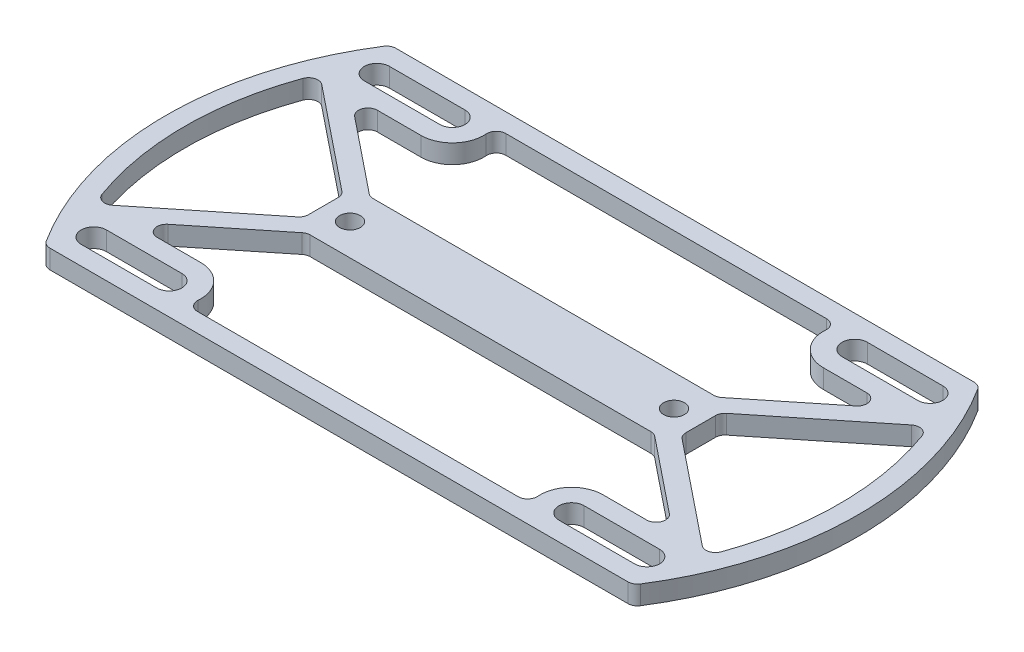
from build123d import *

# Parameters (mm, degrees)
EXTRUDE_1_DEPTH = 3
SKETCH_3_W      = 60
SKETCH_3_H      = 10
EXTRUDE_3_DEPTH = 3
EXTRUDE_4_DEPTH = 3
EXTRUDE_5_DEPTH = 3
FILLET_1_R      = 1.5
FILLET_2_R      = 1.5
M4X0_71_D       = 3.3


with BuildPart() as part:
    # Эскиз1 → Бобышка-Вытянуть1 (new body)
    with BuildSketch(Plane(origin=(0, 0, 0), x_dir=(1, 0, 0), z_dir=(0, 1, 0))):
        with BuildLine():
            Line((8.241767279, 0), (101.758232721, 0))
            ThreePointArc((101.758232721, 0), (110, 27.5), (101.758232721, 55))
            Line((101.758232721, 55), (8.241767279, 55))
            ThreePointArc((8.241767279, 55), (0, 27.5), (8.241767279, 0))
        make_face()
        with BuildLine():
            Line((9.890774129, 3), (100.109225871, 3))
            ThreePointArc((100.109225871, 3), (107, 27.5), (100.109225871, 52))
            Line((100.109225871, 52), (9.890774129, 52))
            ThreePointArc((9.890774129, 52), (3, 27.5), (9.890774129, 3))
        make_face(mode=Mode.SUBTRACT)
    extrude(amount=EXTRUDE_1_DEPTH)

    # Эскиз4 → Бобышка-Вытянуть4 (add, through all)
    with BuildSketch(Plane.XZ):
        with BuildLine():
            Line((27.611432525, -3), (23.02885683, -3))
            ThreePointArc((23.02885683, -3), (25.02885683, -5), (23.02885683, -7))
            Line((23.02885683, -7), (11.02885683, -7))
            ThreePointArc((11.02885683, -7), (9.296806041, -6.000000032), (9.296805985, -4.000000064))
            ThreePointArc((9.296805985, -4.000000064), (8.176529623, -6.057114801), (7.160134889, -8.167489628))
            ThreePointArc((7.160134889, -8.167489628), (8.888465293, -9.51870823), (11.02885683, -10))
            Line((11.02885683, -10), (23.02885683, -10))
            ThreePointArc((23.02885683, -10), (27.212156962, -7.738612788), (27.611432525, -3))
        make_face()
        with BuildLine():
            ThreePointArc((9.296805985, -4.000000064), (10.028856798, -3.267949211), (11.02885683, -3))
            Line((11.02885683, -3), (9.890774129, -3))
            ThreePointArc((9.890774129, -3), (9.590696591, -3.498162612), (9.296805985, -4.000000064))
        make_face()
        with BuildLine():
            Line((86.97114317, -3), (82.388567475, -3))
            ThreePointArc((82.388567475, -3), (82.787843038, -7.738612788), (86.97114317, -10))
            Line((86.97114317, -10), (98.97114317, -10))
            ThreePointArc((98.97114317, -10), (101.111534707, -9.51870823), (102.839865111, -8.167489628))
            ThreePointArc((102.839865111, -8.167489628), (101.823470359, -6.057114766), (100.703193976, -3.999999997))
            ThreePointArc((100.703193976, -3.999999997), (100.703193979, -5.999999998), (98.97114317, -7))
            Line((98.97114317, -7), (86.97114317, -7))
            ThreePointArc((86.97114317, -7), (84.97114317, -5), (86.97114317, -3))
        make_face()
        with BuildLine():
            Line((100.109225871, -3), (98.97114317, -3))
            ThreePointArc((98.97114317, -3), (99.971143169, -3.267949191), (100.703193976, -3.999999997))
            ThreePointArc((100.703193976, -3.999999997), (100.409303389, -3.498162579), (100.109225871, -3))
        make_face()
        with BuildLine():
            ThreePointArc((100.703194034, -50.999999903), (101.823470385, -48.942885182), (102.839865111, -46.832510372))
            ThreePointArc((102.839865111, -46.832510372), (101.111534707, -45.48129177), (98.97114317, -45))
            Line((98.97114317, -45), (86.97114317, -45))
            ThreePointArc((86.97114317, -45), (82.787843038, -47.261387212), (82.388567475, -52))
            Line((82.388567475, -52), (86.97114317, -52))
            ThreePointArc((86.97114317, -52), (84.97114317, -50), (86.97114317, -48))
            Line((86.97114317, -48), (98.97114317, -48))
            ThreePointArc((98.97114317, -48), (100.70319395, -48.999999951), (100.703194034, -50.999999903))
        make_face()
        with BuildLine():
            ThreePointArc((100.109225871, -52), (100.409303419, -51.501837371), (100.703194034, -50.999999903))
            ThreePointArc((100.703194034, -50.999999903), (99.971143219, -51.732050779), (98.97114317, -52))
            Line((98.97114317, -52), (100.109225871, -52))
        make_face()
        with BuildLine():
            ThreePointArc((11.02885683, -45), (8.888465293, -45.48129177), (7.160134889, -46.832510372))
            ThreePointArc((7.160134889, -46.832510372), (8.17652965, -48.942885251), (9.296806044, -51.000000038))
            ThreePointArc((9.296806044, -51.000000038), (9.296806011, -49.000000019), (11.02885683, -48))
            Line((11.02885683, -48), (23.02885683, -48))
            ThreePointArc((23.02885683, -48), (25.02885683, -50), (23.02885683, -52))
            Line((23.02885683, -52), (27.611432525, -52))
            ThreePointArc((27.611432525, -52), (27.212156962, -47.261387212), (23.02885683, -45))
            Line((23.02885683, -45), (11.02885683, -45))
        make_face()
        with BuildLine():
            ThreePointArc((11.02885683, -52), (10.028856848, -51.732050818), (9.296806044, -51.000000038))
            ThreePointArc((9.296806044, -51.000000038), (9.590696621, -51.501837438), (9.890774129, -52))
            Line((9.890774129, -52), (11.02885683, -52))
        make_face()
    extrude(amount=-EXTRUDE_4_DEPTH)



with BuildPart() as body_2:
    # Эскиз3 → Бобышка-Вытянуть3 (new, through all)
    with BuildSketch(Plane.XZ):
        with Locations((55, -27.5)):
            Rectangle(SKETCH_3_W, SKETCH_3_H)
    extrude(amount=-EXTRUDE_3_DEPTH)


with BuildPart() as part_1:
    add(part.part)

    add(body_2.part)  # Бобышка-Вытянуть5 merges body 2
    # Эскиз5 → Бобышка-Вытянуть5 (add, through all)
    with BuildSketch(Plane.XZ):
        Polygon((27.394984288, -22.5), (8.099598255, -6.998127159), (6.220671523, -9.336852098), (25, -24.424125375), (25, -22.5), align=None)
        Polygon((25, -30.575874625), (6.220671523, -45.663147902), (8.099598255, -48.001872841), (27.394984288, -32.5), (25, -32.5), align=None)
        Polygon((101.900401745, -6.998127159), (82.605015712, -22.5), (85, -22.5), (85, -24.424125375), (103.779328477, -9.336852098), align=None)
        Polygon((82.605015712, -32.5), (101.900401745, -48.001872841), (103.779328477, -45.663147902), (85, -30.575874625), (85, -32.5), align=None)
    extrude(amount=-EXTRUDE_5_DEPTH)

    # Скругление1
    fillet_1_edges = [part_1.edges().sort_by_distance(p)[0] for p in [
        (11.836069059, 1.5, -45),
        (6.543612581, 1.5, -45.403697731),
        (27.394984288, 1.5, -32.5),
        (25, 1.5, -30.575874625),
        (98.163930941, 1.5, -10),
        (103.456387419, 1.5, -9.596302269),
        (82.605015712, 1.5, -22.5),
        (85, 1.5, -24.424125375),
        (27.394984288, 1.5, -22.5),
        (98.163930941, 1.5, -45),
        (103.456387419, 1.5, -45.403697731),
        (25, 1.5, -24.424125375),
        (82.605015712, 1.5, -32.5),
        (85, 1.5, -30.575874625),
        (11.836069059, 1.5, -10),
        (6.543612581, 1.5, -9.596302269),
        (27.611432525, 1.5, -52),
        (82.388567475, 1.5, -3),
        (27.611432525, 1.5, -3),
        (82.388567475, 1.5, -52),
    ]]
    fillet(fillet_1_edges, radius=FILLET_1_R)

    # Скругление2
    fillet_2_edges = [part_1.edges().sort_by_distance(p)[0] for p in [
        (8.241767279, 1.5, -55),
        (8.241767279, 1.5, 0),
        (101.758232721, 1.5, 0),
        (101.758232721, 1.5, -55),
    ]]
    fillet(fillet_2_edges, radius=FILLET_2_R)

    # Отверстие обработанное метчиком M4x0.71 (through all)
    with Locations(Plane(origin=(-0.1210586, 0, 3.198200318), x_dir=(-1, 0, 0), z_dir=(0, -1, 0))):
        with Locations((-80.8710586, 30.698200318), (-29.3710586, 30.698200318)):
            Hole(M4X0_71_D / 2)


solid = part_1.part
